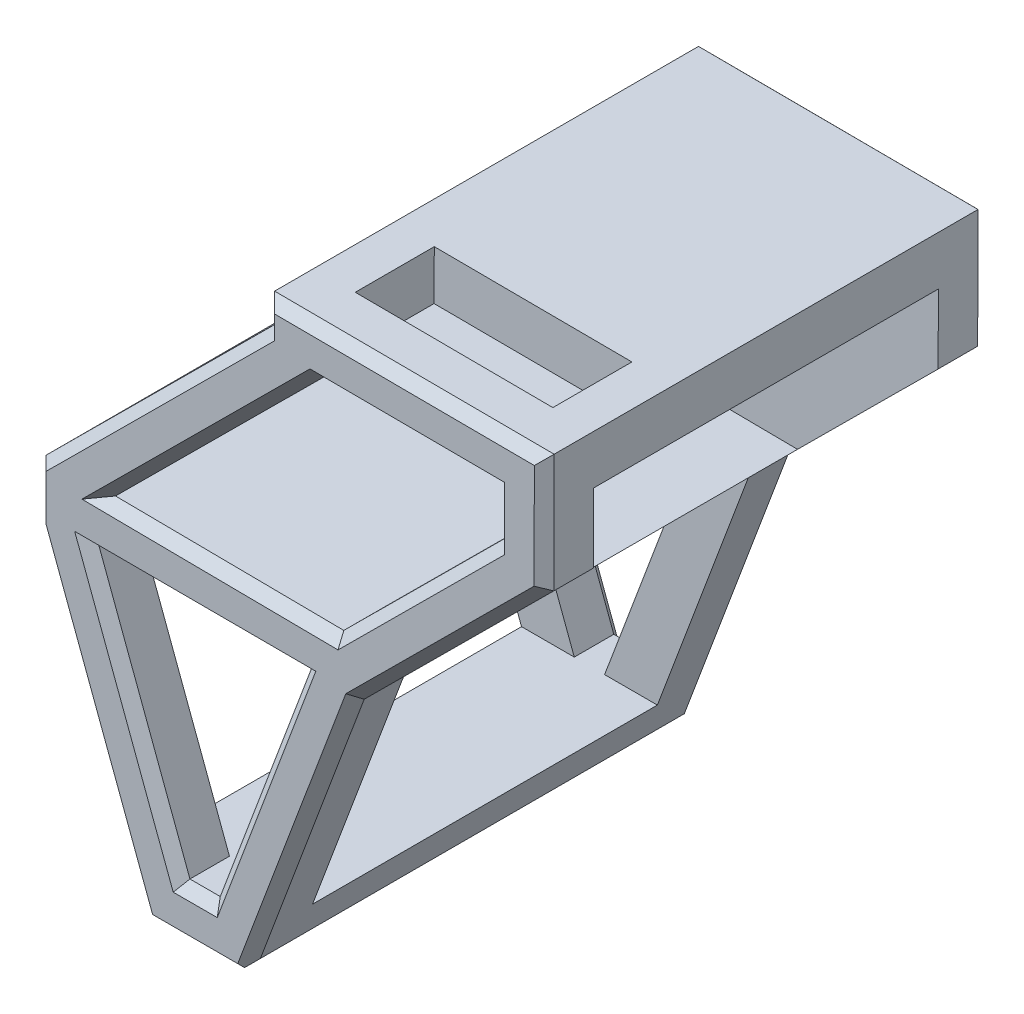
from build123d import *
from OCP.BRepFilletAPI import BRepFilletAPI_MakeChamfer

# Parameters (mm, degrees)
BOSS_EXTRUDE1_DEPTH  = 5
BOSS_EXTRUDE3_DEPTH  = 5
BOSS_EXTRUDE4_DEPTH  = 26.9
SKETCH5_W            = 19.999999999999993
SKETCH5_H            = 5.000000000000007
CUT_EXTRUDE2_DEPTH   = 5.899999999999998
CUT_EXTRUDE3_DEPTH   = 2.949999999999999
BOSS_EXTRUDE5_DEPTH  = 3
BOSS_EXTRUDE6_DEPTH  = 5
BOSS_EXTRUDE7_DEPTH  = 5
BOSS_EXTRUDE8_DEPTH  = 35.00000000000001
BOSS_EXTRUDE10_DEPTH = 35.00000000000001
CHAMFER2_SIZE        = 1
CHAMFER3_SIZE        = 1
CHAMFER3_SIZE2       = 1.7100094702429673
CHAMFER3_SIZE2_2     = 1.7064334239442103


with BuildPart() as part:
    # Model → Boss-Extrude1 (new body)
    with BuildSketch(Plane.XY):
        Polygon((66.34301586992632, 59.26133691593834), (66.3616632211768, 66.2613120784865), (38.072757817888686, 66.41203172728402), (38.064905748927345, 63.464466308167324), (14.948145869822214, 40.47054145556226), (14.934248363068548, 35.253596657867014), (26.03420495541168, 5.596834863804027), (36.03420495541168, 5.596834863804027), (47.134161547754815, 35.167818769025025), (66.32969633331885, 54.261354656975335), align=None)
        Polygon((20.278317449078216, 35.23936050258937), (41.79885052391343, 35.18203159355395), (32.57039139015228, 10.596834863804013), (29.501541711242254, 10.596834863804041), align=None, mode=Mode.SUBTRACT)
        Polygon((43.06467722097951, 61.38536445785425), (61.3483968604827, 61.28795115170147), (61.3352312070632, 56.345734656870185), (45.076420621075016, 40.17331816069535), (21.96849830021793, 40.4012838462993), align=None, mode=Mode.SUBTRACT)
    extrude(amount=BOSS_EXTRUDE1_DEPTH)

    # Sketch3 → Boss-Extrude3 (add)
    with BuildSketch(Plane.XY.offset(5)):
        Polygon((66.36166322117678, 66.2613120784865), (38.072757817888686, 66.41203172728402), (38.064905748927345, 63.464466308167324), (38.064905748927345, 61.38536445785425), (43.06467722097951, 61.38536445785425), (61.3483968604827, 61.28795115170147), (66.34841460158263, 61.28795115170147), align=None)
    extrude(amount=BOSS_EXTRUDE3_DEPTH)

    # Sketch4 → Boss-Extrude4 (add)
    with BuildSketch(Plane.XY.offset(10)):
        Polygon((66.34841460158263, 61.28795115170147), (66.36166322117678, 66.2613120784865), (38.072757817888686, 66.41203172728402), (38.064905748927345, 63.464466308167324), (38.064905748927345, 61.38536445785425), (43.06467722097951, 61.38536445785425), (61.3483968604827, 61.28795115170147), align=None)
    extrude(amount=BOSS_EXTRUDE4_DEPTH)

    # Sketch5 → Cut-Extrude2 (cut)
    with BuildSketch(Plane(origin=(0.3282664498542539, 61.613058556670126, 0), x_dir=(0.999985807195565, -0.005327795738801082, 0), z_dir=(-0.005327795738801082, -0.999985807195565, 0))):
        with Locations((51.87900689947605, 34.400000000000006)):
            Rectangle(SKETCH5_W, SKETCH5_H)
    extrude(amount=-CUT_EXTRUDE2_DEPTH, mode=Mode.SUBTRACT)

    # Sketch7 → Cut-Extrude3 (cut, symmetric)
    with BuildSketch(Plane(origin=(0.32826644985427067, 61.61305855667014, 0), x_dir=(0.999985807195565, -0.005327795738801352, 0), z_dir=(0.005327795738801352, 0.999985807195565, 0))):
        Polygon((42.73701732925542, -31.9), (41.87900689947603, -31.9), (41.87900689947603, -36.900000000000006), (42.73701732945169, -36.900000000000006), align=None)
    extrude(amount=CUT_EXTRUDE3_DEPTH, both=True, mode=Mode.SUBTRACT)

    # Sketch8 → Boss-Extrude5 (add)
    with BuildSketch(Plane.XY.offset(36.900000000000006)):
        Polygon((38.064905748927345, 61.38536445785425), (42.20665461345415, 61.385364457854244), (42.23331794746946, 66.38986479814373), (38.072757817888686, 66.41203172728402), (38.064905748927345, 63.464466308167324), align=None)
        Polygon((66.36166322117678, 66.2613120784865), (62.23303409138075, 66.28330888336767), (62.20641946800804, 61.28795115170146), (66.34841460158263, 61.28795115170147), align=None)
    extrude(amount=BOSS_EXTRUDE5_DEPTH)

    # Sketch9 → Boss-Extrude6 (add)
    with BuildSketch(Plane.XY.offset(39.900000000000006)):
        Polygon((62.233034091380745, 66.28330888336767), (42.23331794746946, 66.38986479814372), (42.20665461345415, 61.38536445785425), (43.064677220980606, 61.38536445785425), (61.3483968604827, 61.28795115170147), (62.20641946800805, 61.28795115170147), align=None)
        Polygon((42.23331794746946, 66.38986479814373), (38.072757817888686, 66.41203172728402), (38.064905748927345, 63.464466308167324), (38.064905748927345, 61.38536445785425), (42.20665461345415, 61.385364457854244), align=None)
        Polygon((62.20641946800804, 61.28795115170146), (66.34841460158263, 61.28795115170147), (66.36166322117678, 66.2613120784865), (62.23303409138075, 66.28330888336767), align=None)
    extrude(amount=BOSS_EXTRUDE6_DEPTH)

    # Sketch10 → Boss-Extrude7 (add)
    with BuildSketch(Plane.XY.offset(44.900000000000006)):
        Polygon((66.34841460158262, 61.28795115170147), (61.3483968604827, 61.28795115170147), (61.3352312070632, 56.34573465687018), (45.076420621075016, 40.17331816069535), (21.968498300217927, 40.4012838462993), (43.06467722097951, 61.38536445785425), (38.064905748927345, 61.38536445785425), (38.064905748927345, 63.464466308167324), (14.948145869822214, 40.470541455562255), (14.934248363068548, 35.25359665786701), (26.03420495541168, 5.596834863804027), (36.03420495541168, 5.596834863804027), (47.134161547754815, 35.16781876902502), (66.32969633331884, 54.261354656975335), align=None)
        Polygon((29.50154171124225, 10.596834863804041), (32.57039139015229, 10.596834863804013), (41.79885052391343, 35.18203159355396), (20.278317449078216, 35.23936050258938), align=None, mode=Mode.SUBTRACT)
    extrude(amount=-BOSS_EXTRUDE7_DEPTH)

    # Sketch11 → Boss-Extrude8 (add)
    with BuildSketch(Plane.XY.offset(5)):
        Polygon((24.162800944848858, 10.596834863804041), (26.03420495541168, 5.596834863804027), (36.03420495541168, 5.596834863804027), (37.91103743212602, 10.596834863804041), align=None)
    extrude(amount=BOSS_EXTRUDE8_DEPTH)

    # Sketch12 → Boss-Extrude10 (add)
    with BuildSketch(Plane.XY.offset(5)):
        Polygon((52.096773051470755, 40.1040605514324), (14.948145869822214, 40.470541455562255), (14.934248363068548, 35.25359665786701), (47.134161547754815, 35.16781876902502), align=None)
    extrude(amount=BOSS_EXTRUDE10_DEPTH)

    # Chamfer2
    chamfer2_edges = [part.edges().sort_by_distance(p)[0] for p in [
        (52.217210519532735, 66.33667190288526, 44.900000000000006),
        (38.068831783408015, 64.93824901772567, 44.900000000000006),
        (52.206537040731654, 61.33665780477786, 44.900000000000006),
        (66.34567977724781, 60.26133336773091, 44.900000000000006),
        (20.484226659240115, 20.42521576083552, 0),
        (14.94119711644538, 37.86206905671464, 0),
        (26.50652580937478, 51.9675038818648, 0),
        (38.068831783408015, 64.93824901772567, 0),
        (61.34181403377295, 58.81684290428582, 44.900000000000006),
        (53.20582591406911, 48.25952640878276, 44.900000000000006),
        (33.52245946064647, 40.287301003497326, 44.900000000000006),
        (32.51658776059872, 50.89332415207677, 44.900000000000006),
        (52.21721051953274, 66.33667190288526, 0),
        (26.50652580937478, 51.967503881864786, 44.900000000000006),
        (14.94119711644538, 37.86206905671463, 44.900000000000006),
        (20.484226659240115, 20.425215760835517, 44.900000000000006),
        (31.03420495541168, 5.596834863804027, 44.900000000000006),
        (41.58418325158325, 20.382326816414523, 44.900000000000006),
        (56.731928940536825, 44.71458671300017, 44.900000000000006),
        (24.889929580160235, 22.91809768319671, 44.900000000000006),
        (31.038583986495823, 35.21069604807167, 44.900000000000006),
        (37.18462095703286, 22.889433228678985, 44.900000000000006),
        (31.035966550697268, 10.596834863804027, 44.900000000000006),
        (66.34567977724782, 60.26133336773091, 0),
        (56.73192894053683, 44.71458671300018, 0),
        (41.58418325158325, 20.382326816414526, 0),
        (31.03420495541168, 5.596834863804027, 0),
        (53.20582591406911, 48.25952640878277, 0),
        (61.34181403377295, 58.81684290428583, 0),
        (52.20653704073111, 61.33665780477786, 0),
        (32.516587760598725, 50.89332415207678, 0),
        (33.52245946064647, 40.287301003497326, 0),
        (37.184620957032855, 22.889433228678982, 0),
        (31.038583986495823, 35.21069604807166, 0),
        (24.889929580160235, 22.918097683196706, 0),
        (31.035966550697268, 10.596834863804027, 0),
    ]]
    chamfer(chamfer2_edges, length=CHAMFER2_SIZE)

    # Chamfer3: one chamfer whose edges measure the first distance from different faces: ONE call of the kernel's chamfer builder (chamfer() names one face for all edges)
    chamfer3_edges_1 = [part.edges().sort_by_distance(p)[0] for p in [
        (36.03420495541168, 5.596834863804027, 22.450000000000003),
    ]]
    chamfer3_side_1 = [part.faces().sort_by_distance(p)[0] for p in [
        (31.03420495541168, 5.596834863804027, 22.450000000000003),
    ]]
    chamfer3_edges_2 = [part.edges().sort_by_distance(p)[0] for p in [
        (26.03420495541168, 5.596834863804027, 22.450000000000003),
    ]]
    chamfer3_side_2 = [part.faces().sort_by_distance(p)[0] for p in [
        (15.121156427701985, 34.75421741218178, 3),
    ]]
    chamfer3 = BRepFilletAPI_MakeChamfer(part.part.solid().wrapped)
    for e in chamfer3_edges_1:
        chamfer3.Add(CHAMFER3_SIZE, CHAMFER3_SIZE2, e.wrapped, chamfer3_side_1[0].wrapped)  # the first distance lies on this face
    for e in chamfer3_edges_2:
        chamfer3.Add(CHAMFER3_SIZE, CHAMFER3_SIZE2_2, e.wrapped, chamfer3_side_2[0].wrapped)  # the first distance lies on this face
    add(Compound.cast(chamfer3.Shape()), mode=Mode.REPLACE)


solid = part.part
